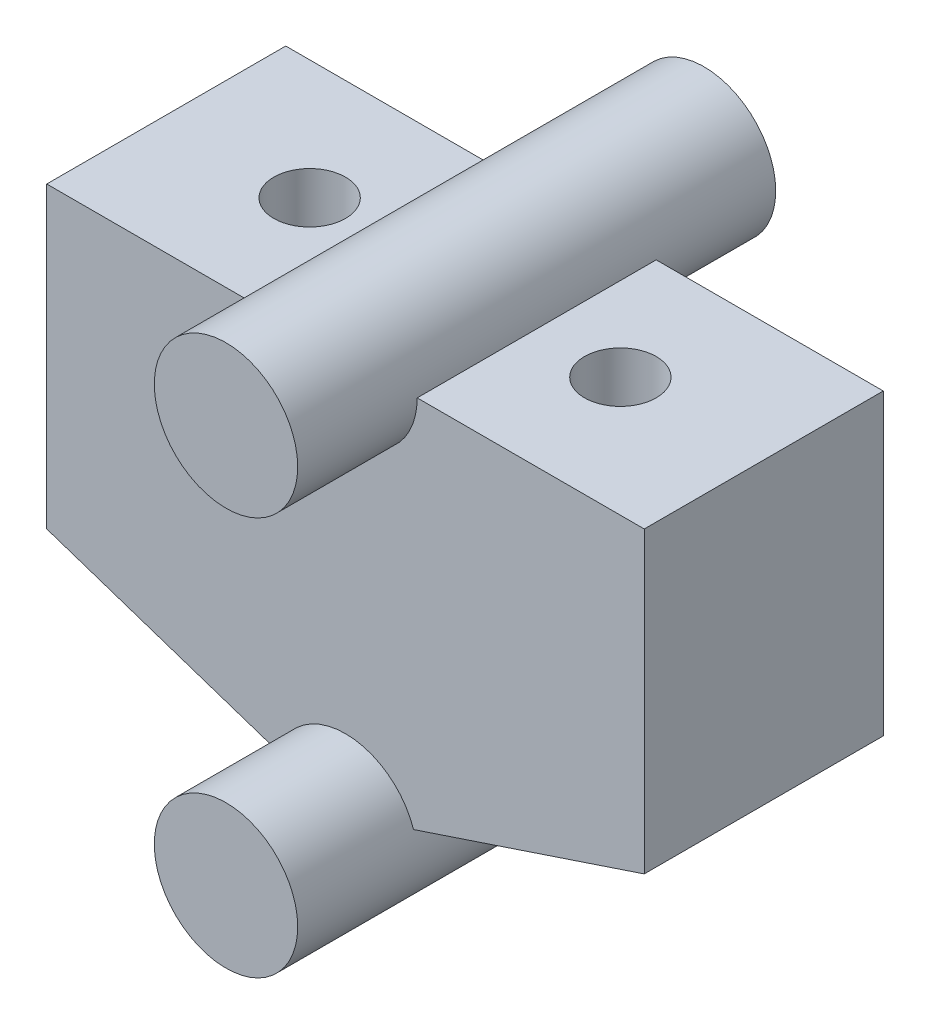
from build123d import *

# Parameters (mm, degrees)
BOSS_EXTRUDE1_DEPTH      = 10
BOSS_EXTRUDE2_DEPTH      = 15
BOSS_EXTRUDE2_DEPTH_BACK = 5
SKETCH2_R                = 1.5
CUT_EXTRUDE1_DEPTH       = 28.713314089
BOSS_EXTRUDE3_DEPTH      = 5
BOSS_EXTRUDE3_DEPTH_BACK = 15
SKETCH3_R                = 3


with BuildPart() as part:
    # Sketch1 → Boss-Extrude1 (new body)
    with BuildSketch(Plane.XY):
        with BuildLine():
            Line((-12.5, 6.25), (-12.5, -6.25))
            Line((-12.5, -6.25), (-2.846049894, -9.467983369))
            ThreePointArc((-2.846049894, -9.467983369), (0, -7.416666667), (2.846049894, -9.467983369))
            Line((2.846049894, -9.467983369), (12.5, -6.25))
            Line((12.5, -6.25), (12.5, 6.25))
            Line((12.5, 6.25), (-12.5, 6.25))
        make_face()
    extrude(amount=BOSS_EXTRUDE1_DEPTH)

    # Sketch1<3> → Boss-Extrude2 (add, two sides: drawn at the far end of the back side and taken through both)
    with BuildSketch(Plane.XY.offset(-BOSS_EXTRUDE2_DEPTH_BACK)):
        with BuildLine():
            ThreePointArc((2.846049894, -9.467983369), (0, -7.416666667), (-2.846049894, -9.467983369))
            ThreePointArc((-2.846049894, -9.467983369), (-0.480546729, -13.37792904), (3, -10.416666667))
            ThreePointArc((3, -10.416666667), (2.961262373, -9.936119938), (2.846049894, -9.467983369))
        make_face()
    extrude(amount=BOSS_EXTRUDE2_DEPTH + BOSS_EXTRUDE2_DEPTH_BACK)

    # Sketch2 → Cut-Extrude1 (cut, through all)
    with BuildSketch(Plane(origin=(0, 6.25, 0), x_dir=(1, 0, 0), z_dir=(0, 1, 0))):
        with Locations((-6.5, -5)):
            Circle(SKETCH2_R)
        with Locations((6.5, -5)):
            Circle(SKETCH2_R)
    extrude(amount=-CUT_EXTRUDE1_DEPTH, mode=Mode.SUBTRACT)

    # Sketch3 → Boss-Extrude3 (add, two sides: drawn at the far end of the back side and taken through both)
    with BuildSketch(Plane.XY.offset(10).offset(-BOSS_EXTRUDE3_DEPTH_BACK)):
        with Locations((0, 6.25)):
            Circle(SKETCH3_R)
    extrude(amount=BOSS_EXTRUDE3_DEPTH + BOSS_EXTRUDE3_DEPTH_BACK)


solid = part.part
